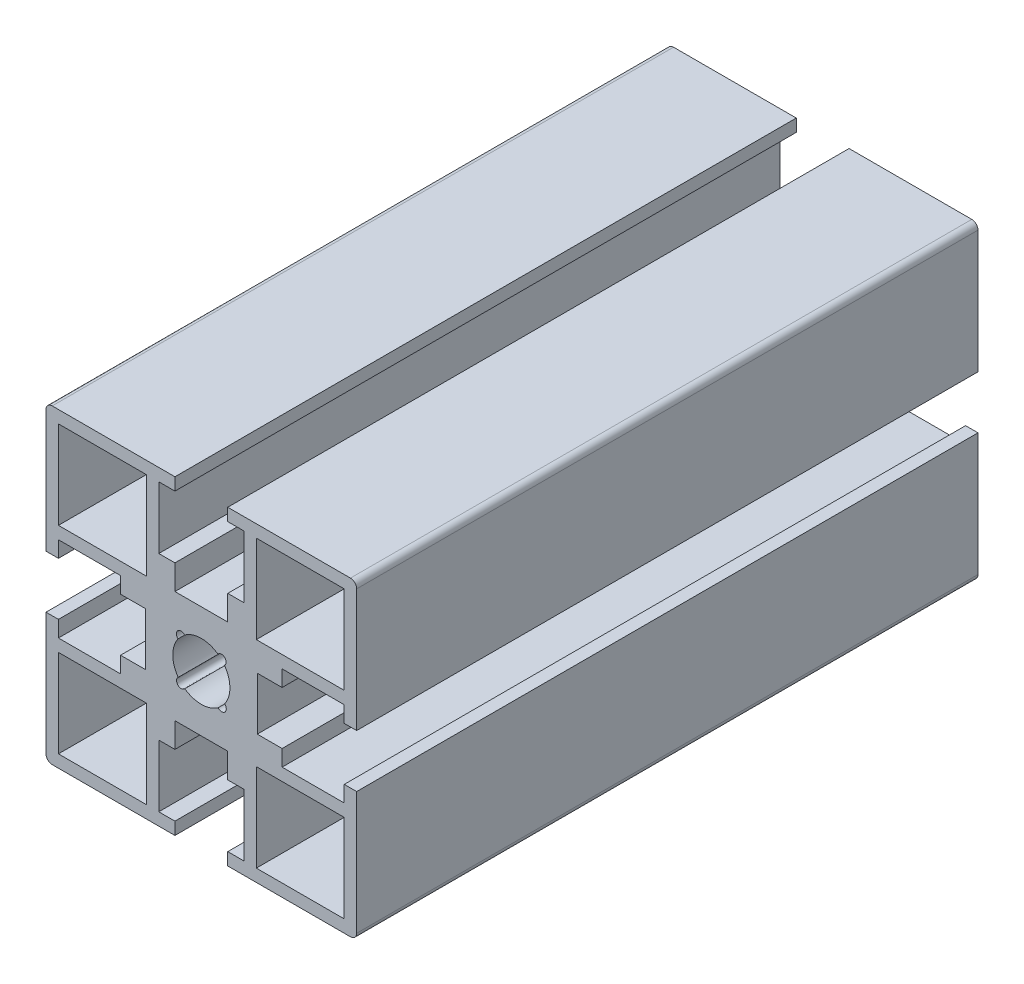
from build123d import *

# Parameters (mm, degrees)
SKETCH_1_W      = 14.15
SKETCH_1_H      = 14.15
EXTRUDE_1_DEPTH = 100


with BuildPart() as part:
    # 草图1 → 凸台-拉伸1 (new body)
    with BuildSketch(Plane.XY):
        with BuildLine():
            Line((-25, 24), (-25, 4.25))
            Line((-25, 4.25), (-23, 4.25))
            Line((-23, 4.25), (-23, 6.85))
            Line((-23, 6.85), (-13, 6.85))
            Line((-13, 6.85), (-13, 4.25))
            Line((-13, 4.25), (-9, 4.25))
            Line((-9, 4.25), (-9, -4.25))
            Line((-9, -4.25), (-13, -4.25))
            Line((-13, -4.25), (-13, -6.85))
            Line((-13, -6.85), (-23, -6.85))
            Line((-23, -6.85), (-23, -4.25))
            Line((-23, -4.25), (-25, -4.25))
            Line((-25, -4.25), (-25, -24))
            ThreePointArc((-25, -24), (-24.707106781, -24.707106781), (-24, -25))
            Line((-24, -25), (-4.25, -25))
            Line((-4.25, -25), (-4.25, -23))
            Line((-4.25, -23), (-6.85, -23))
            Line((-6.85, -23), (-6.85, -13))
            Line((-6.85, -13), (-4.25, -13))
            Line((-4.25, -13), (-4.25, -9))
            Line((-4.25, -9), (4.25, -9))
            Line((4.25, -9), (4.25, -13))
            Line((4.25, -13), (6.85, -13))
            Line((6.85, -13), (6.85, -23))
            Line((6.85, -23), (4.25, -23))
            Line((4.25, -23), (4.25, -25))
            Line((4.25, -25), (24, -25))
            ThreePointArc((24, -25), (24.707106781, -24.707106781), (25, -24))
            Line((25, -24), (25, -4.25))
            Line((25, -4.25), (23, -4.25))
            Line((23, -4.25), (23, -6.85))
            Line((23, -6.85), (13, -6.85))
            Line((13, -6.85), (13, -4.25))
            Line((13, -4.25), (9, -4.25))
            Line((9, -4.25), (9, 4.25))
            Line((9, 4.25), (13, 4.25))
            Line((13, 4.25), (13, 6.85))
            Line((13, 6.85), (23, 6.85))
            Line((23, 6.85), (23, 4.25))
            Line((23, 4.25), (25, 4.25))
            Line((25, 4.25), (25, 24))
            ThreePointArc((25, 24), (24.707106781, 24.707106781), (24, 25))
            Line((24, 25), (4.25, 25))
            Line((4.25, 25), (4.25, 23))
            Line((4.25, 23), (6.85, 23))
            Line((6.85, 23), (6.85, 13))
            Line((6.85, 13), (4.25, 13))
            Line((4.25, 13), (4.25, 9))
            Line((4.25, 9), (-4.25, 9))
            Line((-4.25, 9), (-4.25, 13))
            Line((-4.25, 13), (-6.85, 13))
            Line((-6.85, 13), (-6.85, 23))
            Line((-6.85, 23), (-4.25, 23))
            Line((-4.25, 23), (-4.25, 25))
            Line((-4.25, 25), (-24, 25))
            ThreePointArc((-24, 25), (-24.707106781, 24.707106781), (-25, 24))
        make_face()
        with Locations((15.925, 15.925)):
            Rectangle(SKETCH_1_W, SKETCH_1_H, mode=Mode.SUBTRACT)
        with Locations((15.925, -15.925)):
            Rectangle(SKETCH_1_W, SKETCH_1_H, mode=Mode.SUBTRACT)
        with Locations((-15.925, -15.925)):
            Rectangle(SKETCH_1_W, SKETCH_1_H, mode=Mode.SUBTRACT)
        with Locations((-15.925, 15.925)):
            Rectangle(SKETCH_1_W, SKETCH_1_H, mode=Mode.SUBTRACT)
        with BuildLine():
            ThreePointArc((-3.749249273, 2.665169767), (-4.599959429, -0.019319679), (-3.726730147, -2.696568636))
            ThreePointArc((-3.726730147, -2.696568636), (-3.767099489, -3.798876339), (-2.665169767, -3.749249273))
            ThreePointArc((-2.665169767, -3.749249273), (0.019319679, -4.599959429), (2.696568636, -3.726730147))
            ThreePointArc((2.696568636, -3.726730147), (3.798876339, -3.767099489), (3.749249273, -2.665169767))
            ThreePointArc((3.749249273, -2.665169767), (4.599959429, 0.019319679), (3.726730147, 2.696568636))
            ThreePointArc((3.726730147, 2.696568636), (3.767099489, 3.798876339), (2.665169767, 3.749249273))
            ThreePointArc((2.665169767, 3.749249273), (-0.019319679, 4.599959429), (-2.696568636, 3.726730147))
            ThreePointArc((-2.696568636, 3.726730147), (-3.798876339, 3.767099489), (-3.749249273, 2.665169767))
        make_face(mode=Mode.SUBTRACT)
    extrude(amount=EXTRUDE_1_DEPTH)


solid = part.part
